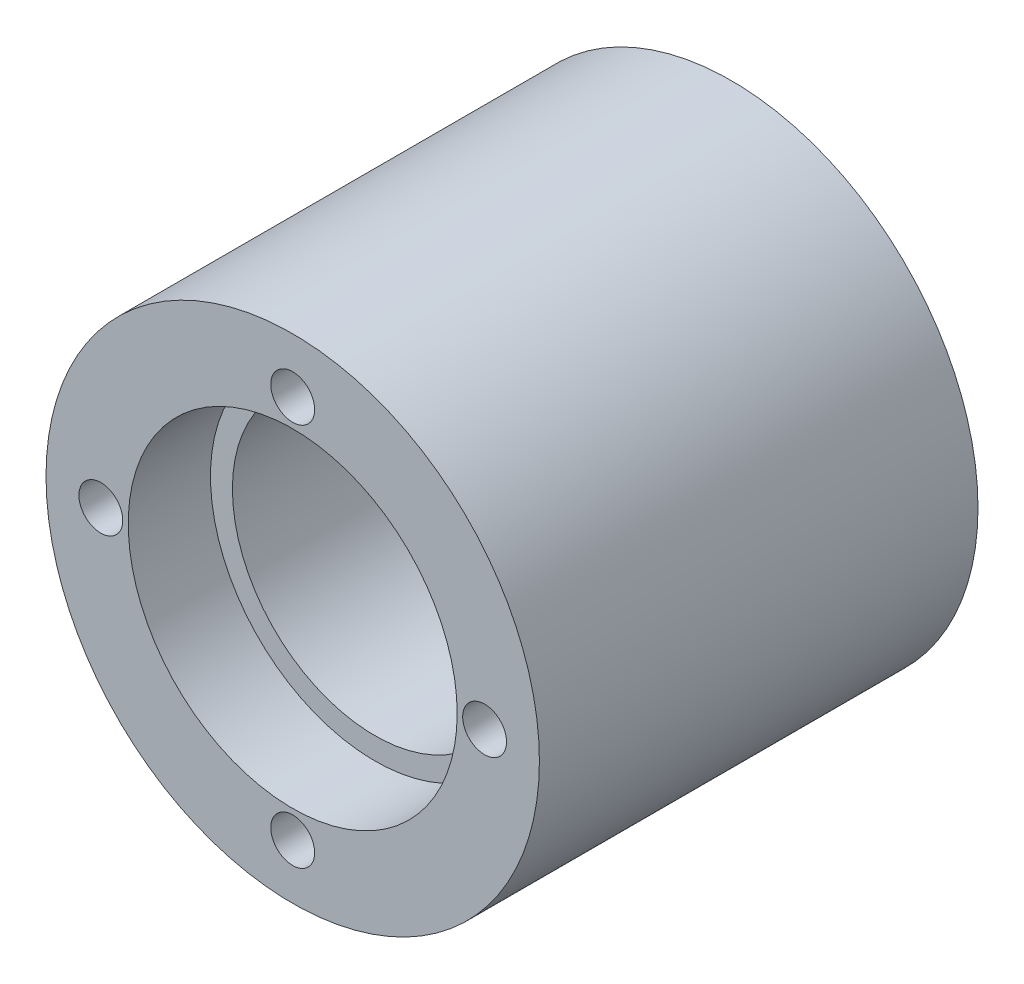
from build123d import *

# Parameters (mm, degrees)
SKETCH1_R           = 22.5
SKETCH1_R_2         = 15
SKETCH1_R_3         = 2
BOSS_EXTRUDE1_DEPTH = 20
SKETCH2_R           = 15
SKETCH2_R_2         = 13
BOSS_EXTRUDE2_DEPTH = 12.5


with BuildPart() as part:
    # Sketch1 → Boss-Extrude1 (new, symmetric)
    with BuildSketch(Plane.XY):
        Circle(SKETCH1_R)
        Circle(SKETCH1_R_2, mode=Mode.SUBTRACT)
        with Locations((0, 17.5)):
            Circle(SKETCH1_R_3, mode=Mode.SUBTRACT)
        with Locations((17.5, 0)):
            Circle(SKETCH1_R_3, mode=Mode.SUBTRACT)
        with Locations((0, -17.5)):
            Circle(SKETCH1_R_3, mode=Mode.SUBTRACT)
        with Locations((-17.5, 0)):
            Circle(SKETCH1_R_3, mode=Mode.SUBTRACT)
    extrude(amount=BOSS_EXTRUDE1_DEPTH, both=True)

    # Sketch2 → Boss-Extrude2 (add, symmetric)
    with BuildSketch(Plane.XY):
        Circle(SKETCH2_R)
        Circle(SKETCH2_R_2, mode=Mode.SUBTRACT)
    extrude(amount=BOSS_EXTRUDE2_DEPTH, both=True)


solid = part.part
